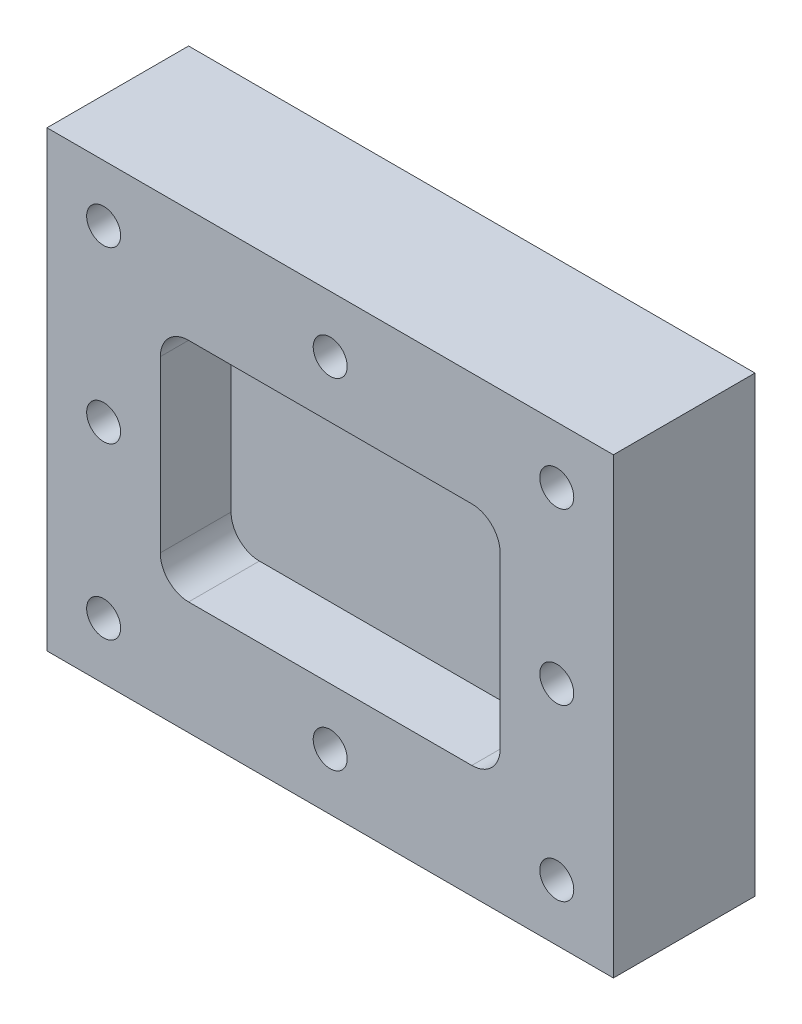
from build123d import *

# Parameters (mm, degrees)
SKETCH1_W          = 200
SKETCH1_H          = 160
BASE_EXTRUDE_DEPTH = 50
CUT_EXTRUDE1_DEPTH = 25
SKETCH3_R          = 6
CUT_EXTRUDE2_DEPTH = 138.477270849


with BuildPart() as part:
    # Sketch1 → Base-Extrude (new body)
    with BuildSketch(Plane.XY):
        Rectangle(SKETCH1_W, SKETCH1_H)
    extrude(amount=-BASE_EXTRUDE_DEPTH)

    # Sketch2 → Cut-Extrude1 (cut)
    with BuildSketch(Plane.XY):
        with BuildLine():
            Line((-50, 40), (50, 40))
            ThreePointArc((50, 40), (57.071067812, 37.071067812), (60, 30))
            Line((60, 30), (60, -30))
            ThreePointArc((60, -30), (57.071067812, -37.071067812), (50, -40))
            Line((50, -40), (-50, -40))
            ThreePointArc((-50, -40), (-57.071067812, -37.071067812), (-60, -30))
            Line((-60, -30), (-60, 30))
            ThreePointArc((-60, 30), (-57.071067812, 37.071067812), (-50, 40))
        make_face()
    extrude(amount=-CUT_EXTRUDE1_DEPTH, mode=Mode.SUBTRACT)

    # Sketch3 → Cut-Extrude2 (cut, through all)
    with BuildSketch(Plane.XY):
        with Locations((-80, 60)):
            Circle(SKETCH3_R)
        with Locations((-80, 0)):
            Circle(SKETCH3_R)
        with Locations((-80, -60)):
            Circle(SKETCH3_R)
        with Locations((80, -60)):
            Circle(SKETCH3_R)
        with Locations((80, 0)):
            Circle(SKETCH3_R)
        with Locations((80, 60)):
            Circle(SKETCH3_R)
        with Locations((0, -60)):
            Circle(SKETCH3_R)
        with Locations((0, 60)):
            Circle(SKETCH3_R)
    extrude(amount=-CUT_EXTRUDE2_DEPTH, mode=Mode.SUBTRACT)


solid = part.part
